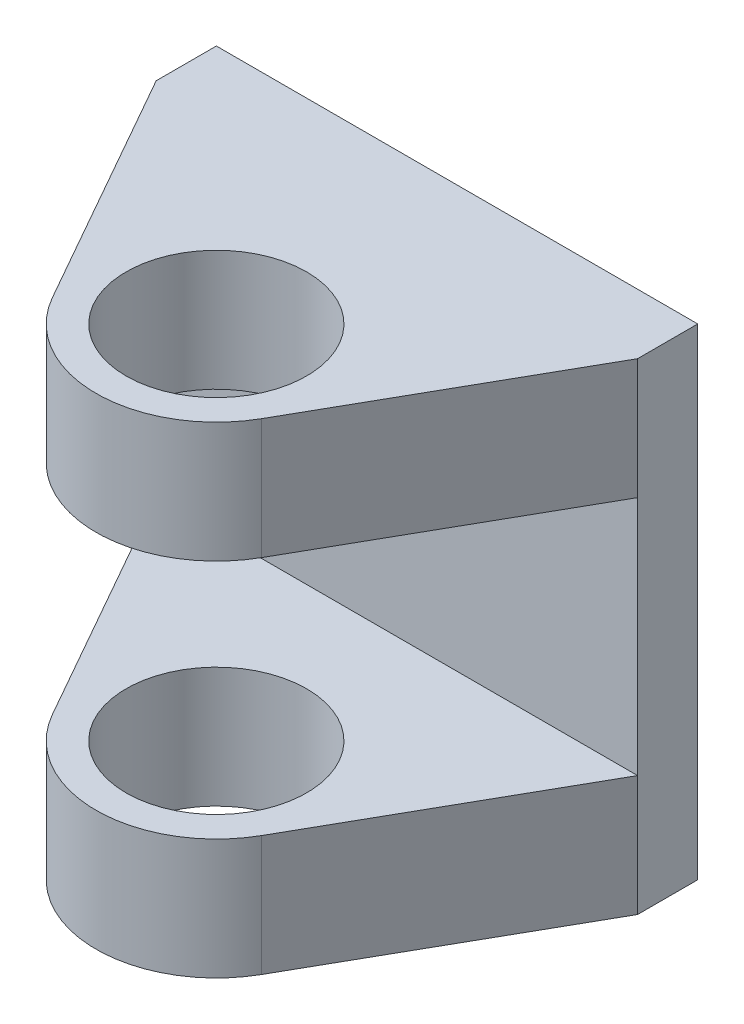
from build123d import *

# Parameters (mm, degrees)
SKETCH_2_W          = 80
SKETCH_2_H          = 80
EXTRUDE_1_DEPTH     = 10
EXTRUDE_2_DEPTH     = 20
EXTRUDE_START       = -20
EXTRUDE_3_DEPTH     = 20
SKETCH_5_R          = 15
CUT_EXTRUDE_1_DEPTH = 80


with BuildPart() as part:
    # 草图2 → 凸台-拉伸1 (new body)
    with BuildSketch(Plane.XY):
        with Locations((40, 40)):
            Rectangle(SKETCH_2_W, SKETCH_2_H)
    extrude(amount=EXTRUDE_1_DEPTH)

    # 草图3 → 凸台-拉伸2 (add)
    with BuildSketch(Plane.XZ):
        with BuildLine():
            Line((0, 10), (22.601818332, 49.864242224))
            ThreePointArc((22.601818332, 49.864242224), (40, 60), (57.398181668, 49.864242224))
            Line((57.398181668, 49.864242224), (80, 10))
            Line((80, 10), (0, 10))
        make_face()
    extrude(amount=-EXTRUDE_2_DEPTH)

    # 草图4 → 凸台-拉伸3 (add)
    with BuildSketch(Plane(origin=(0, 80, 0), x_dir=(1, 0, 0), z_dir=(0, 1, 0)).offset(EXTRUDE_START)):
        with BuildLine():
            Line((80, -10), (57.398181668, -49.864242224))
            ThreePointArc((57.398181668, -49.864242224), (40, -60), (22.601818332, -49.864242224))
            Line((22.601818332, -49.864242224), (0, -10))
            Line((0, -10), (80, -10))
        make_face()
    extrude(amount=EXTRUDE_3_DEPTH)

    # 草图5 → 切除-拉伸1 (cut)
    with BuildSketch(Plane(origin=(0, 80, 0), x_dir=(1, 0, 0), z_dir=(0, 1, 0))):
        with Locations(Location((40, -40, 0), (0, 0, 270))):
            Circle(SKETCH_5_R)
    extrude(amount=-CUT_EXTRUDE_1_DEPTH, mode=Mode.SUBTRACT)


solid = part.part
